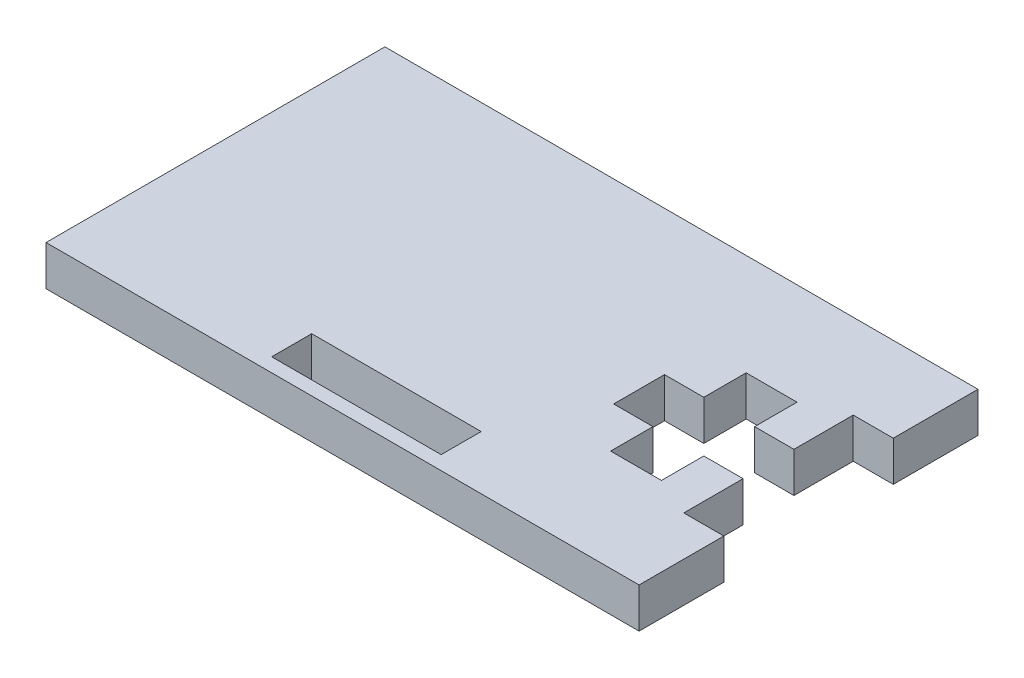
from build123d import *

# Parameters (mm, degrees)
BOSS_EXTRUDE1_DEPTH = 3
SKETCH2_W           = 12.7
SKETCH2_H           = 3
CUT_EXTRUDE1_DEPTH  = 26.772866061


with BuildPart() as part:
    # Sketch1 → Boss-Extrude1 (new body)
    with BuildSketch(Plane(origin=(0, 0, 0), x_dir=(1, 0, 0), z_dir=(0, 1, 0))):
        Polygon((22.225, 6.35), (19.225, 6.35), (19.225, 1.905), (16.28, 1.905), (16.28, 5.08), (12.47, 5.08), (12.47, 1.905), (9.525, 1.905), (9.525, -1.905), (12.47, -1.905), (12.47, -5.08), (16.28, -5.08), (16.28, -1.905), (19.225, -1.905), (19.225, -6.35), (22.225, -6.35), (22.225, -12.7), (-22.225, -12.7), (-22.225, 12.7), (22.225, 12.7), align=None)
    extrude(amount=BOSS_EXTRUDE1_DEPTH)

    # Sketch2 → Cut-Extrude1 (cut, through all)
    with BuildSketch(Plane(origin=(0, 3, 0), x_dir=(1, 0, 0), z_dir=(0, 1, 0))):
        with Locations((0, -10.16)):
            Rectangle(SKETCH2_W, SKETCH2_H)
    extrude(amount=-CUT_EXTRUDE1_DEPTH, mode=Mode.SUBTRACT)


solid = part.part
